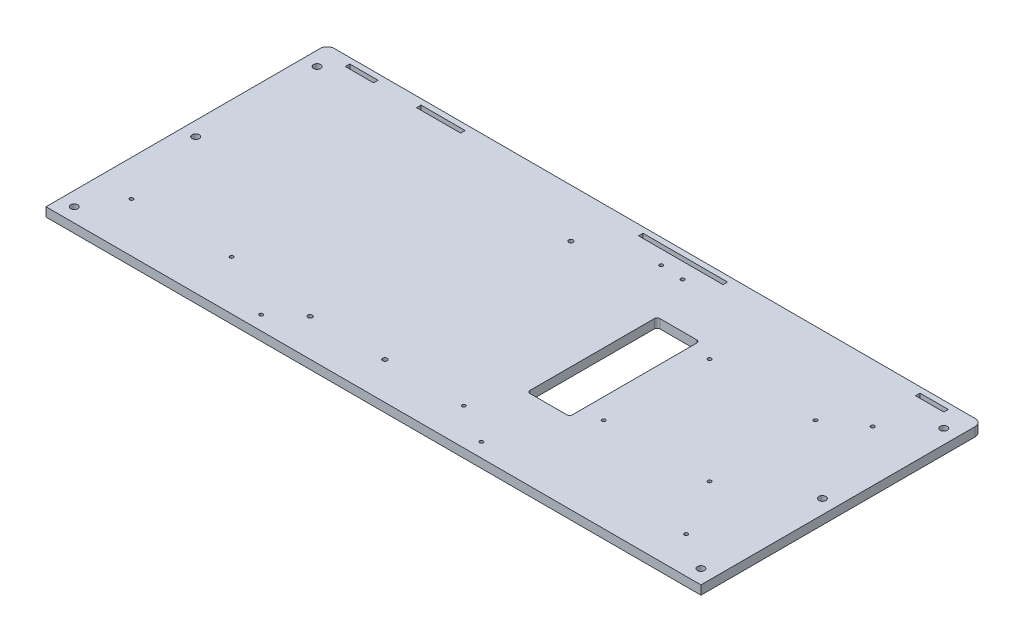
from build123d import *

# Parameters (mm, degrees)
SKETCH1_W           = 463.88
SKETCH1_H           = 192
BOSS_EXTRUDE1_DEPTH = 6.35
SKETCH5_R           = 2.5
CUT_EXTRUDE3_DEPTH  = 484.483469107
SKETCH4_R           = 1.25
SKETCH4_R_2         = 1.6
CUT_EXTRUDE2_DEPTH  = 484.483469107
SKETCH2_W           = 463.88
SKETCH2_H           = 7.175
BOSS_EXTRUDE2_DEPTH = 6.35
SKETCH3_W           = 20
SKETCH3_H           = 3.175
SKETCH3_W_2         = 31.25
SKETCH3_W_3         = 59.87
CUT_EXTRUDE1_DEPTH  = 484.483469107
FILLET1_R           = 5
SKETCH6_W           = 30
SKETCH6_H           = 92
CUT_EXTRUDE4_DEPTH  = 484.483469107
FILLET2_R           = 2


with BuildPart() as part:
    # Sketch1 → Boss-Extrude1 (new body)
    with BuildSketch(Plane(origin=(0, 0, 0), x_dir=(1, 0, 0), z_dir=(0, 1, 0))):
        with Locations((211.74, -96)):
            Rectangle(SKETCH1_W, SKETCH1_H)
    extrude(amount=-BOSS_EXTRUDE1_DEPTH)

    # Sketch5 → Cut-Extrude3 (cut, through all)
    with BuildSketch(Plane(origin=(0, 0, 0), x_dir=(1, 0, 0), z_dir=(0, 1, 0))):
        with Locations(Location((-10.2, -96, 0), (0, 0, 270))):
            Circle(SKETCH5_R)
        with Locations(Location((433.68, -96, 0), (0, 0, 270))):
            Circle(SKETCH5_R)
        with Locations(Location((-10.2, -10, 0), (0, 0, 270))):
            Circle(SKETCH5_R)
        with Locations(Location((-10.2, -182, 0), (0, 0, 270))):
            Circle(SKETCH5_R)
        with Locations(Location((433.68, -182, 0), (0, 0, 270))):
            Circle(SKETCH5_R)
        with Locations(Location((433.68, -10, 0), (0, 0, 270))):
            Circle(SKETCH5_R)
    extrude(amount=-CUT_EXTRUDE3_DEPTH, mode=Mode.SUBTRACT)

    # Sketch4 → Cut-Extrude2 (cut, through all)
    with BuildSketch(Plane(origin=(0, 0, 0), x_dir=(1, 0, 0), z_dir=(0, 1, 0))):
        with Locations(Location((407.33, -34.02, 0), (0, 0, 270))):
            Circle(SKETCH4_R)
        with Locations(Location((407.33, -166.1, 0), (0, 0, 270))):
            Circle(SKETCH4_R)
        with Locations(Location((249.85, -166.1, 0), (0, 0, 270))):
            Circle(SKETCH4_R)
        with Locations(Location((249.85, -11.16, 0), (0, 0, 270))):
            Circle(SKETCH4_R)
        with Locations(Location((186.8, -27.2, 0), (0, 0, 270))):
            Circle(SKETCH4_R_2)
        with Locations(Location((193.5, -165.7, 0), (0, 0, 270))):
            Circle(SKETCH4_R_2)
        with Locations(Location((140.6, -165.7, 0), (0, 0, 270))):
            Circle(SKETCH4_R_2)
        with Locations(Location((122.192994616, -182, 0), (0, 0, 270))):
            Circle(SKETCH4_R)
        with Locations(Location((278.192994616, -182, 0), (0, 0, 270))):
            Circle(SKETCH4_R)
        with Locations(Location((233.5, -10, 0), (0, 0, 270))):
            Circle(SKETCH4_R)
        with Locations(Location((5.25, -157, 0), (0, 0, 270))):
            Circle(SKETCH4_R)
        with Locations(Location((76.25, -157, 0), (0, 0, 270))):
            Circle(SKETCH4_R)
        with Locations(Location((308.24, -50.45, 0), (0, 0, 270))):
            Circle(SKETCH4_R)
        with Locations(Location((383.24, -50.45, 0), (0, 0, 270))):
            Circle(SKETCH4_R)
        with Locations(Location((383.24, -125.45, 0), (0, 0, 270))):
            Circle(SKETCH4_R)
        with Locations(Location((308.24, -125.45, 0), (0, 0, 270))):
            Circle(SKETCH4_R)
    extrude(amount=-CUT_EXTRUDE2_DEPTH, mode=Mode.SUBTRACT)

    # Sketch2 → Boss-Extrude2 (add)
    with BuildSketch(Plane.XZ.offset(6.35)):
        with Locations((211.74, -3.5875)):
            Rectangle(SKETCH2_W, SKETCH2_H)
    extrude(amount=-BOSS_EXTRUDE2_DEPTH)

    # Sketch3 → Cut-Extrude1 (cut, through all)
    with BuildSketch(Plane.XZ.offset(6.35)):
        with Locations((9.8, -1.5875)):
            Rectangle(SKETCH3_W, SKETCH3_H)
        with Locations((65.875, -1.5875)):
            Rectangle(SKETCH3_W_2, SKETCH3_H)
        with Locations((237.435, -1.5875)):
            Rectangle(SKETCH3_W_3, SKETCH3_H)
        with Locations((413.68, -1.5875)):
            Rectangle(SKETCH3_W, SKETCH3_H)
    extrude(amount=-CUT_EXTRUDE1_DEPTH, mode=Mode.SUBTRACT)

    # Fillet1
    fillet1_edges = [part.edges().sort_by_distance(p)[0] for p in [
        (443.68, -3.175, -7.175),
        (-20.2, -3.175, -7.175),
    ]]
    fillet(fillet1_edges, radius=FILLET1_R)

    # Sketch6 → Cut-Extrude4 (cut, through all)
    with BuildSketch(Plane(origin=(0, 0, 0), x_dir=(1, 0, 0), z_dir=(0, 1, 0))):
        with Locations((278.85, -89.18)):
            Rectangle(SKETCH6_W, SKETCH6_H)
    extrude(amount=-CUT_EXTRUDE4_DEPTH, mode=Mode.SUBTRACT)

    # Fillet2
    fillet2_edges = [part.edges().sort_by_distance(p)[0] for p in [
        (263.85, -3.175, 43.18),
        (293.85, -3.175, 43.18),
        (293.85, -3.175, 135.18),
        (263.85, -3.175, 135.18),
    ]]
    fillet(fillet2_edges, radius=FILLET2_R)


solid = part.part
